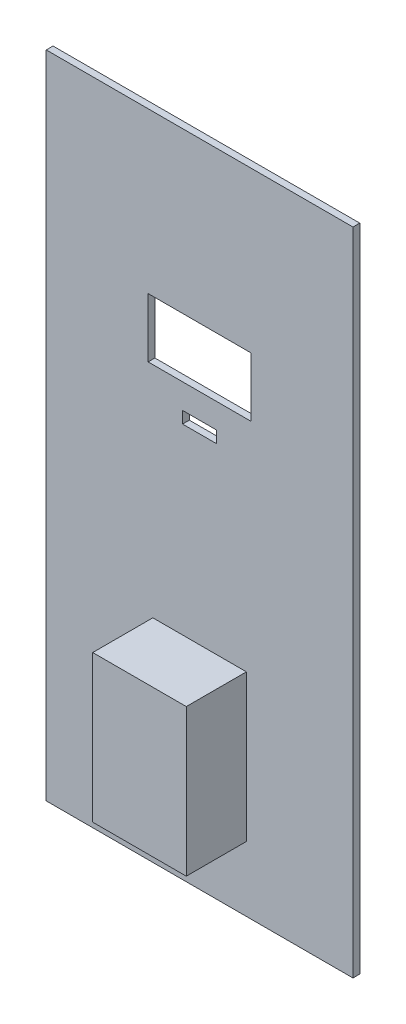
from build123d import *

# Parameters (mm, degrees)
SKETCH1_W           = 575
SKETCH1_H           = 1219.2
BOSS_EXTRUDE1_DEPTH = 12.7
SKETCH2_W           = 193
SKETCH2_H           = 111
SKETCH2_W_2         = 64
SKETCH2_H_2         = 22.19
CUT_EXTRUDE1_DEPTH  = 12.7
SKETCH3_W           = 150
SKETCH3_H           = 250
CUT_EXTRUDE2_DEPTH  = 12.7
SKETCH4_W           = 175.4
SKETCH4_H           = 275.4
SKETCH4_W_2         = 150
SKETCH4_H_2         = 250
BOSS_EXTRUDE2_DEPTH = 100
SKETCH5_W           = 175.4
SKETCH5_H           = 275.4
BOSS_EXTRUDE3_DEPTH = 12.7


with BuildPart() as part:
    # Sketch1 → Boss-Extrude1 (new body)
    with BuildSketch(Plane.XY):
        Rectangle(SKETCH1_W, SKETCH1_H)
    extrude(amount=BOSS_EXTRUDE1_DEPTH)

    # Sketch2 → Cut-Extrude1 (cut)
    with BuildSketch(Plane.XY.offset(12.7)):
        with Locations((0, 254.1)):
            Rectangle(SKETCH2_W, SKETCH2_H)
        with Locations((0, 141.033454098)):
            Rectangle(SKETCH2_W_2, SKETCH2_H_2)
    extrude(amount=-CUT_EXTRUDE1_DEPTH, mode=Mode.SUBTRACT)

    # Sketch3 → Cut-Extrude2 (cut)
    with BuildSketch(Plane(origin=(0, 0, 0), x_dir=(-1, 0, 0), z_dir=(0, 0, -1))):
        with Locations((0, -350.163151911)):
            Rectangle(SKETCH3_W, SKETCH3_H)
    extrude(amount=-CUT_EXTRUDE2_DEPTH, mode=Mode.SUBTRACT)

    # Sketch4 → Boss-Extrude2 (add)
    with BuildSketch(Plane.XY.offset(12.7)):
        with Locations((0, -350.163151911)):
            Rectangle(SKETCH4_W, SKETCH4_H)
        with Locations((0, -350.163151911)):
            Rectangle(SKETCH4_W_2, SKETCH4_H_2, mode=Mode.SUBTRACT)
    extrude(amount=BOSS_EXTRUDE2_DEPTH)

    # Sketch5 → Boss-Extrude3 (add)
    with BuildSketch(Plane.XY.offset(112.7)):
        with Locations((0, -350.163151911)):
            Rectangle(SKETCH5_W, SKETCH5_H)
    extrude(amount=BOSS_EXTRUDE3_DEPTH)


solid = part.part
